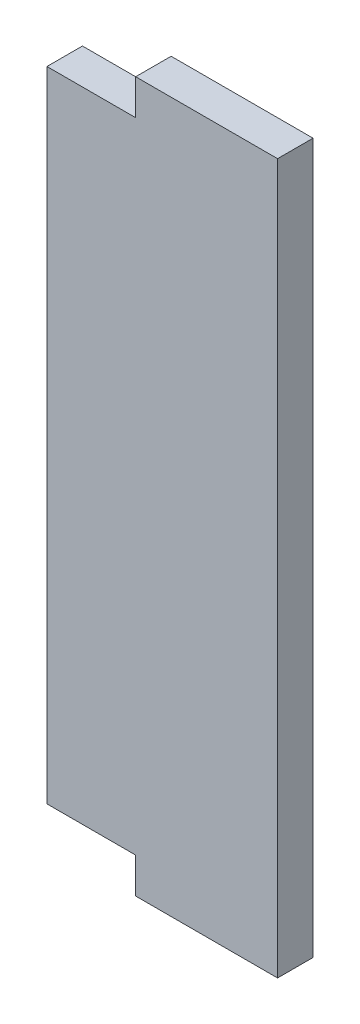
from build123d import *

# Parameters (mm, degrees)
BOSS_EXTRUDE1_DEPTH = 3.175


with BuildPart() as part:
    # Sketch1 → Boss-Extrude1 (new body)
    with BuildSketch(Plane.XY):
        Polygon((14.2875, -3.175), (26.9875, -3.175), (26.9875, 60.325), (14.2875, 60.325), (14.2875, 57.15), (6.35, 57.15), (6.35, 0), (14.2875, 0), align=None)
    extrude(amount=BOSS_EXTRUDE1_DEPTH)


solid = part.part
